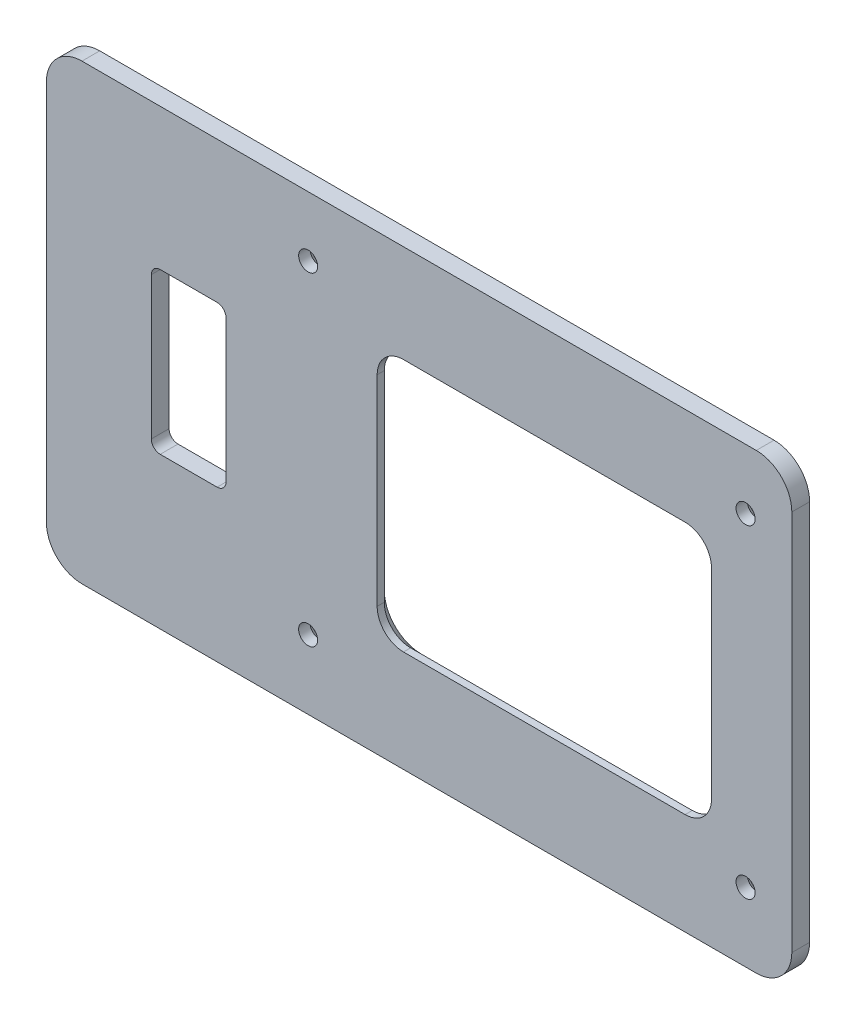
from build123d import *

# Parameters (mm, degrees)
BOSS_EXTRUDE1_DEPTH             = 3.175
F_6_CLEARANCE_HOLE1_AT_2_COUNT  = 2
F_6_CLEARANCE_HOLE1_AT_2_PITCH  = 202.184
F_6_CLEARANCE_HOLE1_AT_3_COUNT  = 2
F_6_CLEARANCE_HOLE1_AT_3_PITCH  = 245.533205315
F_6_CLEARANCE_HOLE1_AT_4_COUNT  = 2
F_6_CLEARANCE_HOLE1_AT_4_PITCH  = 294.732330958
F_6_CLEARANCE_HOLE1_AT_5_COUNT  = 2
F_6_CLEARANCE_HOLE1_AT_5_PITCH  = 209.296
F_6_CLEARANCE_HOLE1_AT_6_COUNT  = 2
F_6_CLEARANCE_HOLE1_AT_6_PITCH  = 172.811757411
F_6_CLEARANCE_HOLE1_AT_7_COUNT  = 2
F_6_CLEARANCE_HOLE1_AT_7_PITCH  = 57.300187604
F_6_CLEARANCE_HOLE1_AT_8_COUNT  = 2
F_6_CLEARANCE_HOLE1_AT_8_PITCH  = 291.003755082
F_6_CLEARANCE_HOLE1_AT_9_COUNT  = 2
F_6_CLEARANCE_HOLE1_AT_9_PITCH  = 232.431512666
F_6_CLEARANCE_HOLE1_AT_10_COUNT = 2
F_6_CLEARANCE_HOLE1_AT_10_PITCH = 101.092
SKETCH23_R                      = 24.765
CUT_EXTRUDE10_DEPTH             = 191.76187976
SKETCH24_W                      = 59.69
SKETCH24_H                      = 45.212
CUT_EXTRUDE11_DEPTH             = 191.76187976
FILLET2_R                       = 4.699
CHAMFER1_SIZE                   = 1.905
M3_CLEARANCE_HOLE3_AT_2_COUNT   = 2
M3_CLEARANCE_HOLE3_AT_2_PITCH   = 49.391408666
M3_CLEARANCE_HOLE3_AT_3_COUNT   = 2
M3_CLEARANCE_HOLE3_AT_3_PITCH   = 69.85
M3_CLEARANCE_HOLE3_AT_4_COUNT   = 2
M3_CLEARANCE_HOLE3_AT_4_PITCH   = 49.391408666
M3_CLEARANCE_HOLE1_D            = 3.6
M3_CLEARANCE_HOLE1_CSINK_D      = 5.7
M3_CLEARANCE_HOLE1_CSINK_ANGLE  = 90
M3_CLEARANCE_HOLE2_AT_2_COUNT   = 2
M3_CLEARANCE_HOLE2_AT_2_PITCH   = 56.70042
M3_CLEARANCE_HOLE2_AT_3_COUNT   = 2
M3_CLEARANCE_HOLE2_AT_3_PITCH   = 102.00589147
M3_CLEARANCE_HOLE2_AT_4_COUNT   = 2
M3_CLEARANCE_HOLE2_AT_4_PITCH   = 109.267844742
M3_CLEARANCE_HOLE2_AT_5_COUNT   = 2
M3_CLEARANCE_HOLE2_AT_5_PITCH   = 65.600653918
M3_CLEARANCE_HOLE2_AT_6_COUNT   = 2
M3_CLEARANCE_HOLE2_AT_6_PITCH   = 76.404880698
M3_CLEARANCE_HOLE2_AT_7_COUNT   = 2
M3_CLEARANCE_HOLE2_AT_7_PITCH   = 27.404059918
M3_CLEARANCE_HOLE2_AT_8_COUNT   = 2
M3_CLEARANCE_HOLE2_AT_8_PITCH   = 55.968061912
SKETCH35_W                      = 13.335
SKETCH35_H                      = 28.575
CUT_EXTRUDE12_DEPTH             = 191.76187976
FILLET1_R                       = 1.5875
F_8_0MM_DOWEL_HOLE1_D           = 8
M3_CLEARANCE_HOLE4_AT_2_COUNT   = 2
M3_CLEARANCE_HOLE4_AT_2_PITCH   = 78.105
M3_CLEARANCE_HOLE4_AT_3_COUNT   = 2
M3_CLEARANCE_HOLE4_AT_3_PITCH   = 97.157075141
M3_CLEARANCE_HOLE4_AT_4_COUNT   = 2
M3_CLEARANCE_HOLE4_AT_4_PITCH   = 57.785
SKETCH42_OUTSIDE_W              = 382.23
SKETCH42_OUTSIDE_H              = 308.826
SKETCH42_OUTSIDE_W_2            = 133.096408578
SKETCH42_OUTSIDE_H_2            = 80.832743403
CUT_EXTRUDE13_DEPTH             = 191.76187976
FILLET3_R                       = 6.35


with BuildPart() as part:
    # Sketch1 → Boss-Extrude1 (new body)
    with BuildSketch(Plane.XY):
        with BuildLine():
            Line((-151.96693, 98.7552), (-151.96693, -98.7552))
            ThreePointArc((-151.96693, -98.7552), (-147.131262957, -110.429532957), (-135.45693, -115.2652))
            Line((-135.45693, -115.2652), (135.45693, -115.2652))
            ThreePointArc((135.45693, -115.2652), (147.131262957, -110.429532957), (151.96693, -98.7552))
            Line((151.96693, -98.7552), (151.96693, 98.7552))
            ThreePointArc((151.96693, 98.7552), (147.131262957, 110.429532957), (135.45693, 115.2652))
            Line((135.45693, 115.2652), (-135.45693, 115.2652))
            ThreePointArc((-135.45693, 115.2652), (-147.131262957, 110.429532957), (-151.96693, 98.7552))
        make_face()
    extrude(amount=-BOSS_EXTRUDE1_DEPTH)

    # Sketch3 → #6 Clearance Hole1 (revolve, cut)
    with BuildSketch(Plane(origin=(101.092, 104.648, 0), x_dir=(0, -1, 0), z_dir=(1, 0, 0))):
        Polygon((0, 0), (0, 3.175), (3.3655, 3.175), (2.15265, 2.157298012), (2.15265, 0), align=None)
    f_6_clearance_hole1 = revolve(axis=Axis((101.092, 104.648, 6.35), (0, 0, -1)), mode=Mode.SUBTRACT)

    # #6 Clearance Hole1 at 2: #6 Clearance Hole1 ×2
    with Locations(*[(-i * F_6_CLEARANCE_HOLE1_AT_2_PITCH, 0, 0) for i in range(1, F_6_CLEARANCE_HOLE1_AT_2_COUNT)]):
        add(f_6_clearance_hole1, mode=Mode.SUBTRACT)

    # #6 Clearance Hole1 at 3: #6 Clearance Hole1 ×2
    with Locations(*[Vector(-0.9858574105677721, -0.1675862942743448, 0) * (i * F_6_CLEARANCE_HOLE1_AT_3_PITCH) for i in range(1, F_6_CLEARANCE_HOLE1_AT_3_COUNT)]):
        add(f_6_clearance_hole1, mode=Mode.SUBTRACT)

    # #6 Clearance Hole1 at 4: #6 Clearance Hole1 ×2
    with Locations(*[Vector(-0.8212900471859665, -0.5705108749123656, 0) * (i * F_6_CLEARANCE_HOLE1_AT_4_PITCH) for i in range(1, F_6_CLEARANCE_HOLE1_AT_4_COUNT)]):
        add(f_6_clearance_hole1, mode=Mode.SUBTRACT)

    # #6 Clearance Hole1 at 5: #6 Clearance Hole1 ×2
    with Locations(*[(0, -i * F_6_CLEARANCE_HOLE1_AT_5_PITCH, 0) for i in range(1, F_6_CLEARANCE_HOLE1_AT_5_COUNT)]):
        add(f_6_clearance_hole1, mode=Mode.SUBTRACT)

    # #6 Clearance Hole1 at 6: #6 Clearance Hole1 ×2
    with Locations(*[Vector(0.23075241289949347, -0.9730124993755537, 0) * (i * F_6_CLEARANCE_HOLE1_AT_6_PITCH) for i in range(1, F_6_CLEARANCE_HOLE1_AT_6_COUNT)]):
        add(f_6_clearance_hole1, mode=Mode.SUBTRACT)

    # #6 Clearance Hole1 at 7: #6 Clearance Hole1 ×2
    with Locations(*[Vector(0.6959266918172804, -0.7181128320927402, 0) * (i * F_6_CLEARANCE_HOLE1_AT_7_PITCH) for i in range(1, F_6_CLEARANCE_HOLE1_AT_7_COUNT)]):
        add(f_6_clearance_hole1, mode=Mode.SUBTRACT)

    # #6 Clearance Hole1 at 8: #6 Clearance Hole1 ×2
    with Locations(*[Vector(-0.6947814125038304, -0.719220959677332, 0) * (i * F_6_CLEARANCE_HOLE1_AT_8_PITCH) for i in range(1, F_6_CLEARANCE_HOLE1_AT_8_COUNT)]):
        add(f_6_clearance_hole1, mode=Mode.SUBTRACT)

    # #6 Clearance Hole1 at 9: #6 Clearance Hole1 ×2
    with Locations(*[Vector(-0.4349324187613887, -0.9004630981391565, 0) * (i * F_6_CLEARANCE_HOLE1_AT_9_PITCH) for i in range(1, F_6_CLEARANCE_HOLE1_AT_9_COUNT)]):
        add(f_6_clearance_hole1, mode=Mode.SUBTRACT)

    # #6 Clearance Hole1 at 10: #6 Clearance Hole1 ×2
    with Locations(*[(-i * F_6_CLEARANCE_HOLE1_AT_10_PITCH, 0, 0) for i in range(1, F_6_CLEARANCE_HOLE1_AT_10_COUNT)]):
        add(f_6_clearance_hole1, mode=Mode.SUBTRACT)

    # Sketch23 → Cut-Extrude10 (cut, through all)
    with BuildSketch(Plane.XY):
        with Locations((104.26573, 42.164)):
            Circle(SKETCH23_R)
    extrude(amount=-CUT_EXTRUDE10_DEPTH, mode=Mode.SUBTRACT)

    # Sketch24 → Cut-Extrude11 (cut, through all)
    with BuildSketch(Plane.XY):
        with Locations((-63.06693, 16.31442)):
            Rectangle(SKETCH24_W, SKETCH24_H)
    extrude(amount=-CUT_EXTRUDE11_DEPTH, mode=Mode.SUBTRACT)

    # Fillet2
    fillet2_edges = [part.edges().sort_by_distance(p)[0] for p in [
        (-92.91193, -6.29158, -1.5875),
        (-92.91193, 38.92042, -1.5875),
        (-33.22193, 38.92042, -1.5875),
        (-33.22193, -6.29158, -1.5875),
    ]]
    fillet(fillet2_edges, radius=FILLET2_R)

    # Chamfer1
    chamfer1_edges = [part.edges().sort_by_distance(p)[0] for p in [
        (-33.22193, 16.31442, -3.175),
        (-63.06693, -6.29158, -3.175),
        (-92.91193, 16.31442, -3.175),
        (-63.06693, 38.92042, -3.175),
        (-34.598235235, -4.915274765, -3.175),
        (-91.535624765, -4.915274765, -3.175),
        (-91.535624765, 37.544114765, -3.175),
        (-34.598235235, 37.544114765, -3.175),
    ]]
    chamfer(chamfer1_edges, length=CHAMFER1_SIZE)

    # Sketch30 → M3 Clearance Hole3 (revolve, cut)
    with BuildSketch(Plane(origin=(79.570025667, 66.859704333, 0), x_dir=(0, -1, 0), z_dir=(1, 0, 0))):
        Polygon((0, 0), (0, 3.175), (2.85, 3.175), (1.8, 2.125), (1.8, 0), align=None)
    m3_clearance_hole3 = revolve(axis=Axis((79.570025667, 66.859704333, 6.35), (0, 0, -1)), mode=Mode.SUBTRACT)

    # M3 Clearance Hole3 at 2: M3 Clearance Hole3 ×2
    with Locations(*[(i * M3_CLEARANCE_HOLE3_AT_2_PITCH, 0, 0) for i in range(1, M3_CLEARANCE_HOLE3_AT_2_COUNT)]):
        add(m3_clearance_hole3, mode=Mode.SUBTRACT)

    # M3 Clearance Hole3 at 3: M3 Clearance Hole3 ×2
    with Locations(*[Vector(0.7071067811865477, -0.7071067811865475, 0) * (i * M3_CLEARANCE_HOLE3_AT_3_PITCH) for i in range(1, M3_CLEARANCE_HOLE3_AT_3_COUNT)]):
        add(m3_clearance_hole3, mode=Mode.SUBTRACT)

    # M3 Clearance Hole3 at 4: M3 Clearance Hole3 ×2
    with Locations(*[(0, -i * M3_CLEARANCE_HOLE3_AT_4_PITCH, 0) for i in range(1, M3_CLEARANCE_HOLE3_AT_4_COUNT)]):
        add(m3_clearance_hole3, mode=Mode.SUBTRACT)

    # M3 Clearance Hole1 (through all)
    with Locations(Plane(origin=(0, 0, -3.175), x_dir=(-1, 0, 0), z_dir=(0, 0, -1))):
        with Locations((17.67693, -38.5952), (117.67693, -38.5952), (117.67693, -88.5952), (17.67693, -88.5952)):
            CounterSinkHole(M3_CLEARANCE_HOLE1_D / 2, M3_CLEARANCE_HOLE1_CSINK_D / 2, counter_sink_angle=M3_CLEARANCE_HOLE1_CSINK_ANGLE)

    # Sketch34 → M3 Clearance Hole2 (revolve, cut)
    with BuildSketch(Plane(origin=(25.25193, -75.5297, 0), x_dir=(0, -1, 0), z_dir=(1, 0, 0))):
        Polygon((0, 0), (0, 3.175), (2.85, 3.175), (1.8, 2.125), (1.8, 0), align=None)
    m3_clearance_hole2 = revolve(axis=Axis((25.25193, -75.5297, 6.35), (0, 0, -1)), mode=Mode.SUBTRACT)

    # M3 Clearance Hole2 at 2: M3 Clearance Hole2 ×2
    with Locations(*[(i * M3_CLEARANCE_HOLE2_AT_2_PITCH, 0, 0) for i in range(1, M3_CLEARANCE_HOLE2_AT_2_COUNT)]):
        add(m3_clearance_hole2, mode=Mode.SUBTRACT)

    # M3 Clearance Hole2 at 3: M3 Clearance Hole2 ×2
    with Locations(*[Vector(0.9983315525499471, -0.05774176290357108, 0) * (i * M3_CLEARANCE_HOLE2_AT_3_PITCH) for i in range(1, M3_CLEARANCE_HOLE2_AT_3_COUNT)]):
        add(m3_clearance_hole2, mode=Mode.SUBTRACT)

    # M3 Clearance Hole2 at 4: M3 Clearance Hole2 ×2
    with Locations(*[Vector(0.9319823250907686, 0.36250371821321364, 0) * (i * M3_CLEARANCE_HOLE2_AT_4_PITCH) for i in range(1, M3_CLEARANCE_HOLE2_AT_4_COUNT)]):
        add(m3_clearance_hole2, mode=Mode.SUBTRACT)

    # M3 Clearance Hole2 at 5: M3 Clearance Hole2 ×2
    with Locations(*[Vector(0.9959611085814934, -0.089785690358334, 0) * (i * M3_CLEARANCE_HOLE2_AT_5_PITCH) for i in range(1, M3_CLEARANCE_HOLE2_AT_5_COUNT)]):
        add(m3_clearance_hole2, mode=Mode.SUBTRACT)

    # M3 Clearance Hole2 at 6: M3 Clearance Hole2 ×2
    with Locations(*[Vector(0.8551246910281444, 0.5184223787550272, 0) * (i * M3_CLEARANCE_HOLE2_AT_6_PITCH) for i in range(1, M3_CLEARANCE_HOLE2_AT_6_COUNT)]):
        add(m3_clearance_hole2, mode=Mode.SUBTRACT)

    # M3 Clearance Hole2 at 7: M3 Clearance Hole2 ×2
    with Locations(*[Vector(0.2682084341495708, 0.9633609063331537, 0) * (i * M3_CLEARANCE_HOLE2_AT_7_PITCH) for i in range(1, M3_CLEARANCE_HOLE2_AT_7_COUNT)]):
        add(m3_clearance_hole2, mode=Mode.SUBTRACT)

    # M3 Clearance Hole2 at 8: M3 Clearance Hole2 ×2
    with Locations(*[Vector(0.8817603882311722, 0.47169759141468215, 0) * (i * M3_CLEARANCE_HOLE2_AT_8_PITCH) for i in range(1, M3_CLEARANCE_HOLE2_AT_8_COUNT)]):
        add(m3_clearance_hole2, mode=Mode.SUBTRACT)

    # Sketch35 → Cut-Extrude12 (cut, through all)
    with BuildSketch(Plane.XY):
        with Locations((-126.56693, 16.8402)):
            Rectangle(SKETCH35_W, SKETCH35_H)
    extrude(amount=-CUT_EXTRUDE12_DEPTH, mode=Mode.SUBTRACT)

    # Fillet1
    fillet1_edges = [part.edges().sort_by_distance(p)[0] for p in [
        (-133.23443, 2.5527, -1.5875),
        (-133.23443, 31.1277, -1.5875),
        (-119.89943, 31.1277, -1.5875),
        (-119.89943, 2.5527, -1.5875),
    ]]
    fillet(fillet1_edges, radius=FILLET1_R)

    # Ø8.0mm Dowel Hole1 (through all)
    with Locations(Plane(origin=(0, 0, -3.175), x_dir=(-1, 0, 0), z_dir=(0, 0, -1))):
        with Locations((12.26693, 3.61442), (12.26693, 29.01442)):
            Hole(F_8_0MM_DOWEL_HOLE1_D / 2)

    # Sketch39 → M3 Clearance Hole4 (revolve, cut)
    with BuildSketch(Plane(origin=(-105.23093, 45.65142, 0), x_dir=(0, -1, 0), z_dir=(1, 0, 0))):
        Polygon((0, 0), (0, 3.175), (2.85, 3.175), (1.7, 2.025), (1.7, 0), align=None)
    m3_clearance_hole4 = revolve(axis=Axis((-105.23093, 45.65142, 6.35), (0, 0, -1)), mode=Mode.SUBTRACT)

    # M3 Clearance Hole4 at 2: M3 Clearance Hole4 ×2
    with Locations(*[(i * M3_CLEARANCE_HOLE4_AT_2_PITCH, 0, 0) for i in range(1, M3_CLEARANCE_HOLE4_AT_2_COUNT)]):
        add(m3_clearance_hole4, mode=Mode.SUBTRACT)

    # M3 Clearance Hole4 at 3: M3 Clearance Hole4 ×2
    with Locations(*[Vector(0.8039043979705941, -0.5947585383359678, 0) * (i * M3_CLEARANCE_HOLE4_AT_3_PITCH) for i in range(1, M3_CLEARANCE_HOLE4_AT_3_COUNT)]):
        add(m3_clearance_hole4, mode=Mode.SUBTRACT)

    # M3 Clearance Hole4 at 4: M3 Clearance Hole4 ×2
    with Locations(*[(0, -i * M3_CLEARANCE_HOLE4_AT_4_PITCH, 0) for i in range(1, M3_CLEARANCE_HOLE4_AT_4_COUNT)]):
        add(m3_clearance_hole4, mode=Mode.SUBTRACT)

    # Sketch42 outside → Cut-Extrude13 (cut, through all)
    with BuildSketch(Plane(origin=(0, 0, -3.175), x_dir=(-1, 0, 0), z_dir=(0, 0, -1))):
        Rectangle(SKETCH42_OUTSIDE_W, SKETCH42_OUTSIDE_H)
        with Locations((85.418725711, 15.951898655)):
            Rectangle(SKETCH42_OUTSIDE_W_2, SKETCH42_OUTSIDE_H_2, mode=Mode.SUBTRACT)
    extrude(amount=-CUT_EXTRUDE13_DEPTH, mode=Mode.SUBTRACT)

    # Fillet3
    fillet3_edges = [part.edges().sort_by_distance(p)[0] for p in [
        (-18.870521422, 56.368270356, -1.5875),
        (-151.96693, 56.368270356, -1.5875),
        (-151.96693, -24.464473047, -1.5875),
        (-18.870521422, -24.464473047, -1.5875),
    ]]
    fillet(fillet3_edges, radius=FILLET3_R)


solid = part.part
